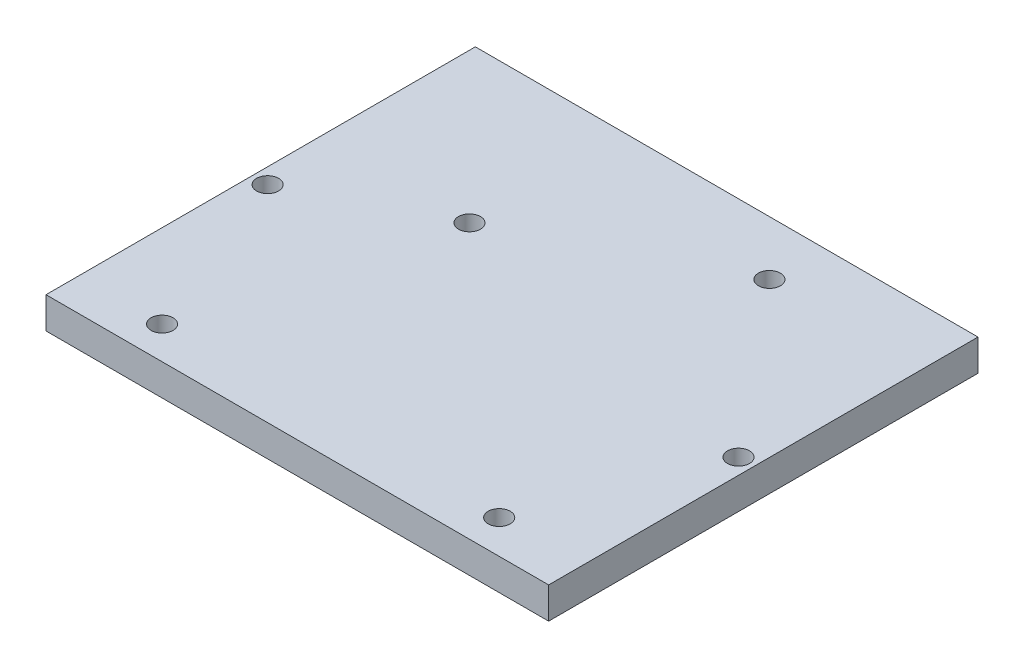
from build123d import *

# Parameters (mm, degrees)
SKETCH_1_W      = 48
SKETCH_1_H      = 41
SKETCH_1_R      = 1.05
EXTRUDE_1_DEPTH = 3


with BuildPart() as part:
    # 草图1 → 凸台-拉伸1 (new body)
    with BuildSketch(Plane(origin=(0, 0, 0), x_dir=(1, 0, 0), z_dir=(0, 1, 0))):
        with Locations((24, 20.5)):
            Rectangle(SKETCH_1_W, SKETCH_1_H)
        with Locations(Location((7.97, 3.11, 0), (0, 0, 270))):
            Circle(SKETCH_1_R, mode=Mode.SUBTRACT)
        with Locations(Location((1.48, 19.68, 0), (0, 0, 270))):
            Circle(SKETCH_1_R, mode=Mode.SUBTRACT)
        with Locations(Location((14.28, 26.16, 0), (0, 0, 270))):
            Circle(SKETCH_1_R, mode=Mode.SUBTRACT)
        with Locations(Location((40.07, 3.21, 0), (0, 0, 270))):
            Circle(SKETCH_1_R, mode=Mode.SUBTRACT)
        with Locations(Location((46.5, 19.63, 0), (0, 0, 270))):
            Circle(SKETCH_1_R, mode=Mode.SUBTRACT)
        with Locations(Location((33.28, 35.8, 0), (0, 0, 270))):
            Circle(SKETCH_1_R, mode=Mode.SUBTRACT)
    extrude(amount=EXTRUDE_1_DEPTH)


solid = part.part
